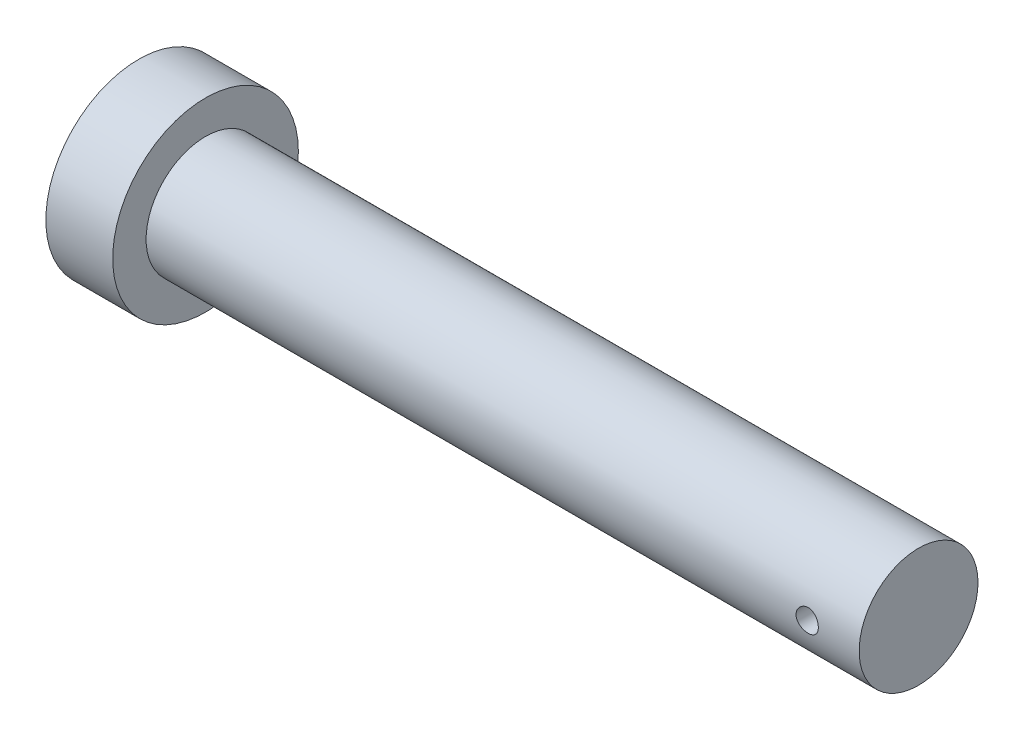
from build123d import *

# Parameters (mm, degrees)
SKETCH1_R           = 12.5
BOSS_EXTRUDE1_DEPTH = 9
SKETCH2_R           = 8
BOSS_EXTRUDE2_DEPTH = 96
SKETCH4_R           = 1.5
CUT_EXTRUDE1_DEPTH  = 96


with BuildPart() as part:
    # Sketch1 → Boss-Extrude1 (new body)
    with BuildSketch(Plane(origin=(0, 0, 0), x_dir=(0, 0, -1), z_dir=(1, 0, 0))):
        Circle(SKETCH1_R)
    extrude(amount=BOSS_EXTRUDE1_DEPTH)

    # Sketch2 → Boss-Extrude2 (add)
    with BuildSketch(Plane(origin=(9, 0, 0), x_dir=(0, 0, -1), z_dir=(1, 0, 0))):
        Circle(SKETCH2_R)
    extrude(amount=BOSS_EXTRUDE2_DEPTH)

    # Sketch4 → Cut-Extrude1 (cut)
    with BuildSketch(Plane.XY.offset(8)):
        with Locations((98, 0)):
            Circle(SKETCH4_R)
    extrude(amount=-CUT_EXTRUDE1_DEPTH, mode=Mode.SUBTRACT)


solid = part.part
